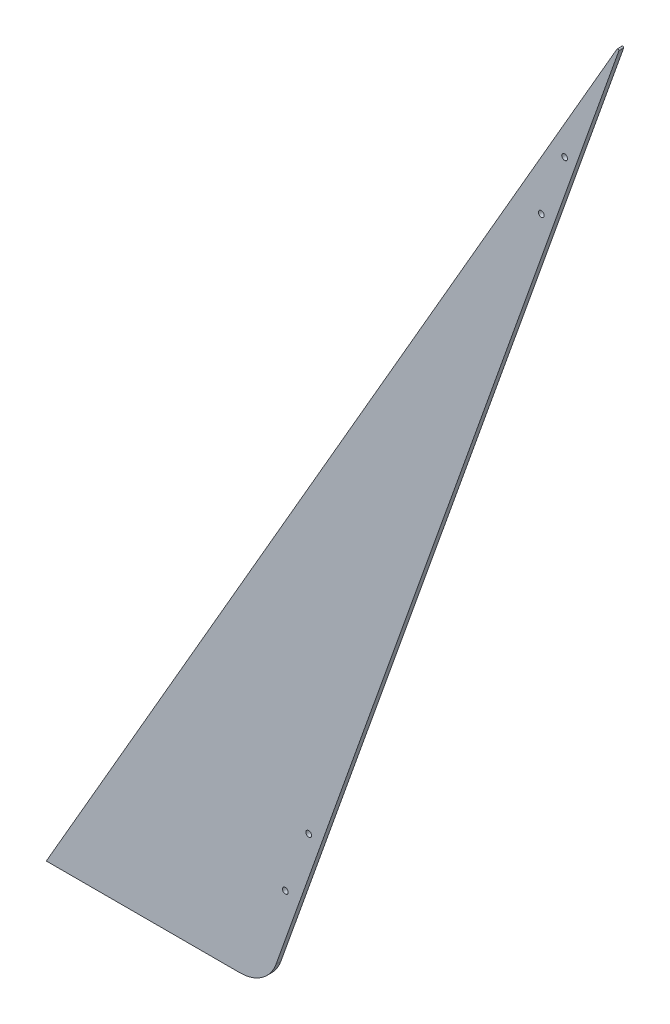
from build123d import *

# Parameters (mm, degrees)
BOSS_EXTRUDE1_DEPTH = 5
FILLET1_R           = 40
FILLET2_R           = 1
SKETCH2_R           = 3
CUT_EXTRUDE1_DEPTH  = 1192.271634267


with BuildPart() as part:
    # Sketch1 → Boss-Extrude1 (new body)
    with BuildSketch(Plane.XY):
        Polygon((0, 0), (230, 0), (600.444279957, 1040), align=None)
    extrude(amount=BOSS_EXTRUDE1_DEPTH)

    # Fillet1
    fillet1_edges = [part.edges().sort_by_distance(p)[0] for p in [
        (230, 0, 2.5),
    ]]
    fillet(fillet1_edges, radius=FILLET1_R)

    # Fillet2
    fillet2_edges = [part.edges().sort_by_distance(p)[0] for p in [
        (600.444279957, 1040, 2.5),
    ]]
    fillet(fillet2_edges, radius=FILLET2_R)

    # Sketch2 → Cut-Extrude1 (cut, through all)
    with BuildSketch(Plane.XY.offset(5)):
        with Locations((249.147691634, 97.758565682)):
            Circle(SKETCH2_R)
        with Locations((273.494533389, 161.250543889)):
            Circle(SKETCH2_R)
        with Locations((515.885480129, 842.044902128)):
            Circle(SKETCH2_R)
        with Locations((540.232321884, 905.536880334)):
            Circle(SKETCH2_R)
    extrude(amount=-CUT_EXTRUDE1_DEPTH, mode=Mode.SUBTRACT)


solid = part.part
